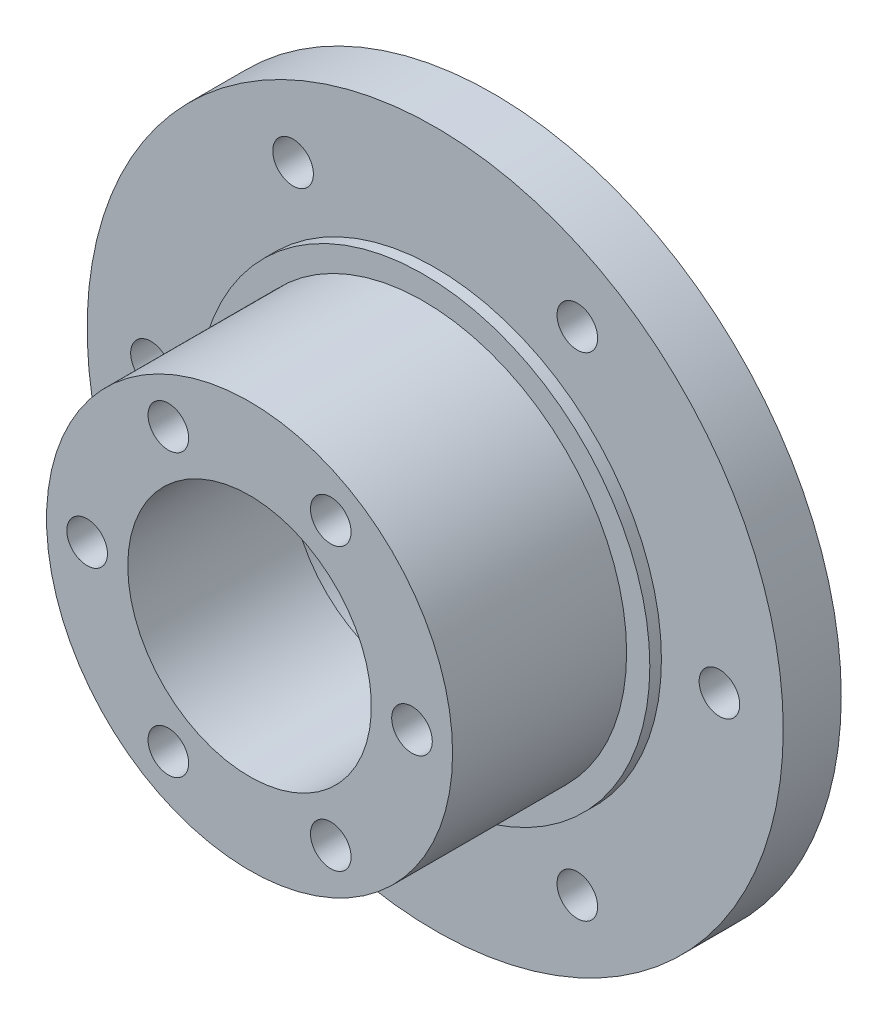
from build123d import *

# Parameters (mm, degrees)
SKETCH1_R           = 30
BOSS_EXTRUDE1_DEPTH = 5
SKETCH2_R           = 19.5
BOSS_EXTRUDE2_DEPTH = 1
SKETCH3_R           = 17.5
BOSS_EXTRUDE3_DEPTH = 15
SKETCH4_R           = 12.025
CUT_EXTRUDE1_DEPTH  = 7
SKETCH5_R           = 10.5
CUT_EXTRUDE2_DEPTH  = 45.676615807
SKETCH6_R           = 1.75
CUT_EXTRUDE3_DEPTH  = 46.343136195
SKETCH7_R           = 1.75
CUT_EXTRUDE4_DEPTH  = 12


with BuildPart() as part:
    # Sketch1 → Boss-Extrude1 (new body)
    with BuildSketch(Plane.XY):
        Circle(SKETCH1_R)
    extrude(amount=BOSS_EXTRUDE1_DEPTH)

    # Sketch2 → Boss-Extrude2 (add)
    with BuildSketch(Plane.XY.offset(5)):
        Circle(SKETCH2_R)
    extrude(amount=BOSS_EXTRUDE2_DEPTH)

    # Sketch3 → Boss-Extrude3 (add)
    with BuildSketch(Plane.XY.offset(6)):
        Circle(SKETCH3_R)
    extrude(amount=BOSS_EXTRUDE3_DEPTH)

    # Sketch4 → Cut-Extrude1 (cut)
    with BuildSketch(Plane(origin=(0, 0, 0), x_dir=(-1, 0, 0), z_dir=(0, 0, -1))):
        Circle(SKETCH4_R)
    extrude(amount=-CUT_EXTRUDE1_DEPTH, mode=Mode.SUBTRACT)

    # Sketch5 → Cut-Extrude2 (cut, through all)
    with BuildSketch(Plane(origin=(0, 0, 7), x_dir=(-1, 0, 0), z_dir=(0, 0, -1))):
        Circle(SKETCH5_R)
    extrude(amount=-CUT_EXTRUDE2_DEPTH, mode=Mode.SUBTRACT)

    # Sketch6 → Cut-Extrude3 (cut, through all)
    with BuildSketch(Plane.XY.offset(5)):
        with Locations((24.5, 0)):
            Circle(SKETCH6_R)
        with Locations((12.25, -21.217622393)):
            Circle(SKETCH6_R)
        with Locations((-12.25, -21.217622393)):
            Circle(SKETCH6_R)
        with Locations((-24.5, 0)):
            Circle(SKETCH6_R)
        with Locations((-12.25, 21.217622393)):
            Circle(SKETCH6_R)
        with Locations((12.25, 21.217622393)):
            Circle(SKETCH6_R)
    extrude(amount=-CUT_EXTRUDE3_DEPTH, mode=Mode.SUBTRACT)

    # Sketch7 → Cut-Extrude4 (cut)
    with BuildSketch(Plane.XY.offset(21)):
        with Locations((14, 0)):
            Circle(SKETCH7_R)
        with Locations((7, -12.124355653)):
            Circle(SKETCH7_R)
        with Locations((-7, -12.124355653)):
            Circle(SKETCH7_R)
        with Locations((-14, 0)):
            Circle(SKETCH7_R)
        with Locations((-7, 12.124355653)):
            Circle(SKETCH7_R)
        with Locations((7, 12.124355653)):
            Circle(SKETCH7_R)
    extrude(amount=-CUT_EXTRUDE4_DEPTH, mode=Mode.SUBTRACT)


solid = part.part
